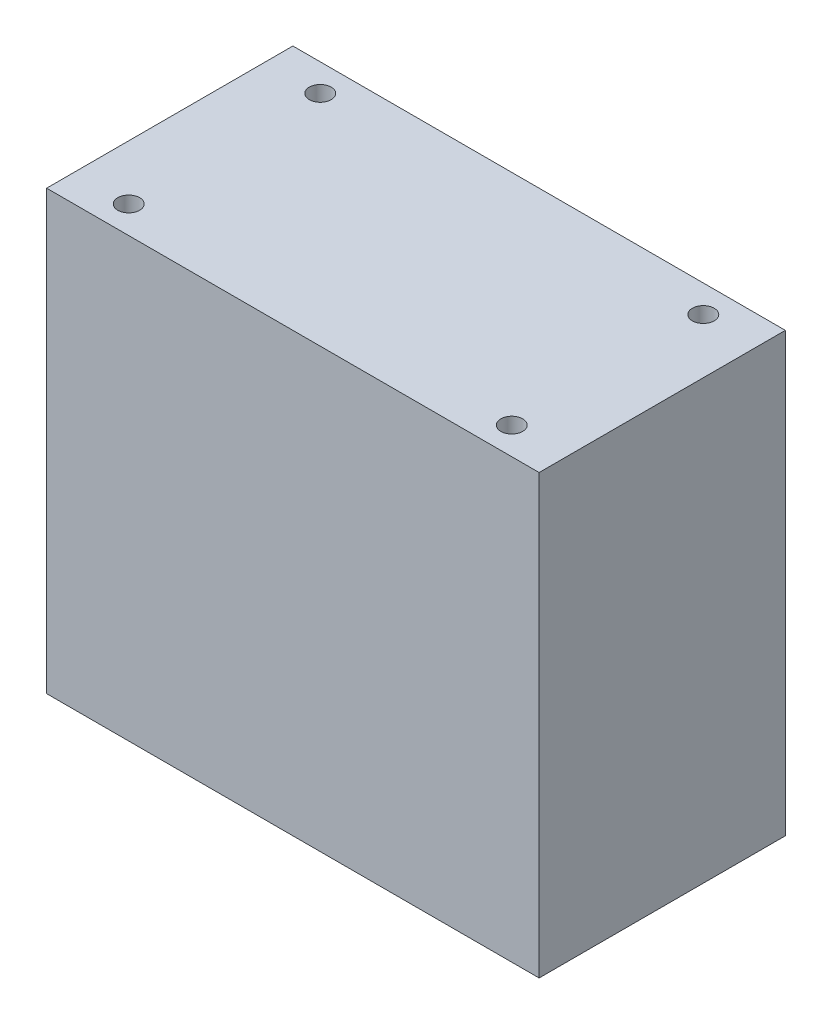
from build123d import *

# Parameters (mm, degrees)
SKETCH_1_W      = 90
SKETCH_1_H      = 45
SKETCH_1_R      = 2
EXTRUDE_1_DEPTH = 80


with BuildPart() as part:
    # 草图1 → 凸台-拉伸1 (new body)
    with BuildSketch(Plane(origin=(0, 0, 0), x_dir=(1, 0, 0), z_dir=(0, 1, 0))):
        Rectangle(SKETCH_1_W, SKETCH_1_H)
        with Locations(Location((-35, 17.5, 0), (0, 0, 270))):
            Circle(SKETCH_1_R, mode=Mode.SUBTRACT)
        with Locations(Location((-35, -17.5, 0), (0, 0, 270))):
            Circle(SKETCH_1_R, mode=Mode.SUBTRACT)
        with Locations(Location((35, -17.5, 0), (0, 0, 270))):
            Circle(SKETCH_1_R, mode=Mode.SUBTRACT)
        with Locations(Location((35, 17.5, 0), (0, 0, 270))):
            Circle(SKETCH_1_R, mode=Mode.SUBTRACT)
    extrude(amount=EXTRUDE_1_DEPTH)


solid = part.part
